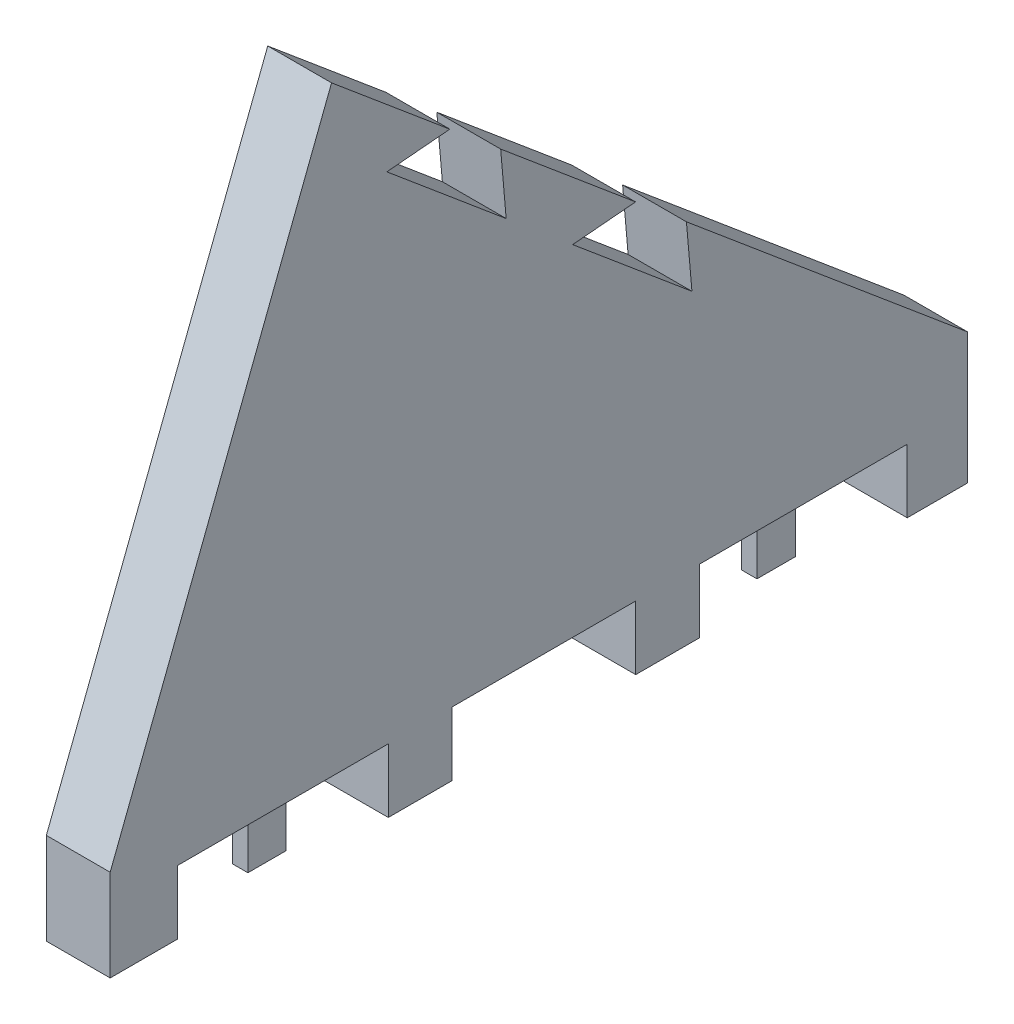
from build123d import *

# Parameters (mm, degrees)
BOSS_EXTRUDE2_DEPTH = 5
BOSS_EXTRUDE3_START = 2.05
SKETCH2_4_W         = 3
SKETCH2_4_H         = 5
BOSS_EXTRUDE3_DEPTH = 1.2


with BuildPart() as part:
    # Sketch2 → Boss-Extrude2 (new body)
    with BuildSketch(Plane(origin=(0, 0, 0), x_dir=(0, 0, -1), z_dir=(1, 0, 0))):
        Polygon((7.192857145, 5.102e-06), (12.192857145, 5.102e-06), (12.192857145, 4.998838637), (18.442857145, 4.998838637), (21.442857145, 4.998838637), (27.892857145, 4.998838637), (28.465326986, 4.998838637), (28.465326986, 0.00505468), (33.199274922, 0.00505468), (33.199274922, 10.252338302), (17.953083095, 23.045412241), (14.873464569, 25.62951901), (11.16619607, 28.740286641), (11.597594987, 23.809374456), (2.251852781, 31.651383294), (7.182764965, 32.082782211), (-3.38864835, 40.953251225), (-2.957249433, 36.02233904), (-12.302991639, 43.864347878), (-7.372079454, 44.295746795), (-16.638484456, 52.071183815), (-32.892857145, 10.00505468), (-33.983618254, 7.182177505), (-33.983618254, 0.00505468), (-33.199274922, 0.00505468), (-28.691927734, 0.00505468), (-28.691927734, 4.998838637), (-27.892857145, 4.998838637), (-21.442857145, 4.998838637), (-18.442857145, 4.998838637), (-12.192857145, 4.998838637), (-12.192857145, 4.163e-06), (-7.192857145, 4.163e-06), (-7.192857145, 5.000004163), (7.192857145, 5.000004163), align=None)
    extrude(amount=BOSS_EXTRUDE2_DEPTH)

    # Sketch2<4> → Boss-Extrude3 (add)
    with BuildSketch(Plane(origin=(0, 0, 0), x_dir=(0, 0, -1), z_dir=(1, 0, 0)).offset(BOSS_EXTRUDE3_START)):
        with Locations((19.942857145, 2.498838637)):
            Rectangle(SKETCH2_4_W, SKETCH2_4_H)
        with Locations((-19.942857145, 2.498838637)):
            Rectangle(SKETCH2_4_W, SKETCH2_4_H)
    extrude(amount=BOSS_EXTRUDE3_DEPTH)


solid = part.part
